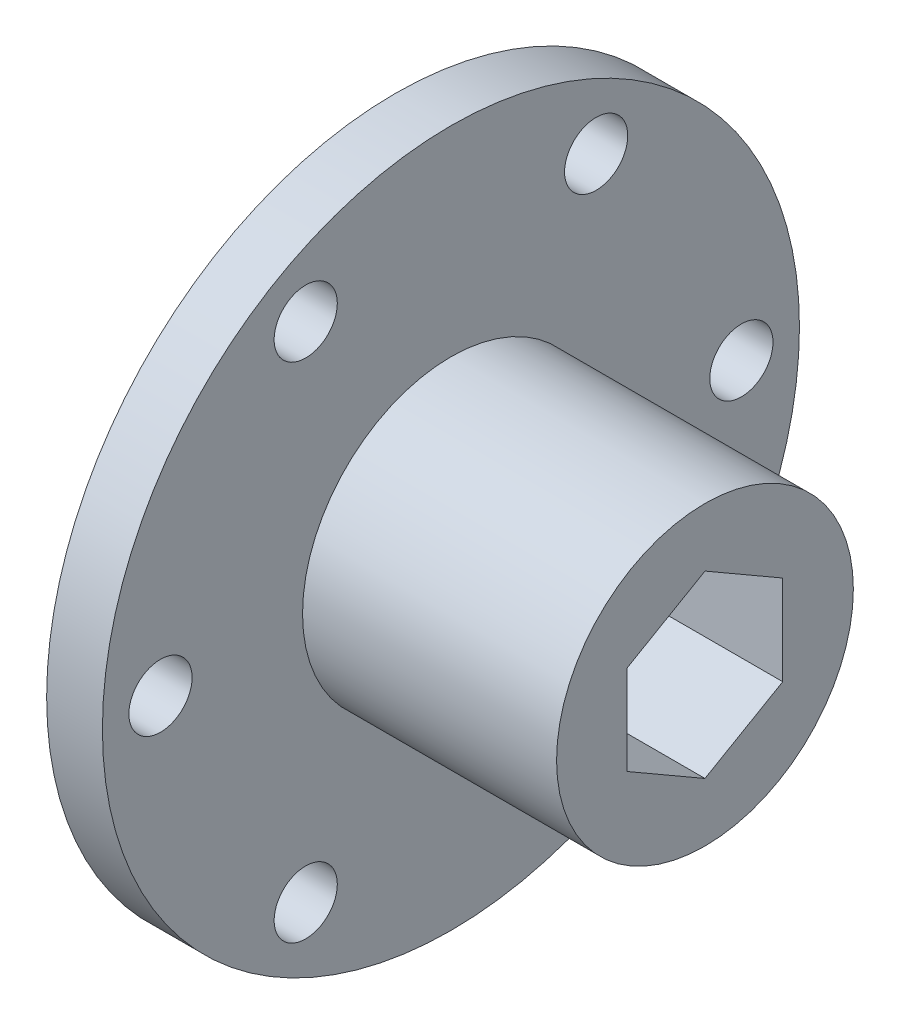
from build123d import *

# Parameters (mm, degrees)
SKETCH1_W           = 4.572
SKETCH1_H           = 28.575
SKETCH2_R           = 12.1666
BOSS_EXTRUDE1_DEPTH = 20.828
CUT_EXTRUDE1_DEPTH  = 48.730716001
HOLE1_D             = 5.1816
HOLE1_DEPTH         = 25.4


with BuildPart() as part:
    # Sketch1 → Revolve1 (revolve)
    with BuildSketch(Plane.XY, mode=Mode.PRIVATE) as revolve1_sk:
        with Locations((-15.321066246, 14.2875)):
            Rectangle(SKETCH1_W, SKETCH1_H)
    revolve(revolve1_sk.sketch.rotate(Axis((-17.607066246, 0, 0), (1, 0, 0)), 270), axis=Axis((-17.607066246, 0, 0), (1, 0, 0)))

    # Sketch2 → Boss-Extrude1 (add)
    with BuildSketch(Plane(origin=(-13.035066246, 0, 0), x_dir=(0, 0, -1), z_dir=(1, 0, 0))):
        Circle(SKETCH2_R)
    extrude(amount=BOSS_EXTRUDE1_DEPTH)

    # Sketch3 → Cut-Extrude1 (cut, through all)
    with BuildSketch(Plane.ZY.offset(17.607066246)):
        Polygon((0, -7.361697812), (6.3754, -3.680858906), (6.3754, 3.680818906), (0, 7.361657812), (-6.3754, 3.680818906), (-6.3754, -3.680858906), align=None)
    extrude(amount=-CUT_EXTRUDE1_DEPTH, mode=Mode.SUBTRACT)

    # Hole1
    with Locations(Plane.ZY.offset(17.607066246)):
        with Locations((11.90625, -20.622229928), (-11.90625, -20.622229928), (-23.8125, 0), (-11.90625, 20.622229928), (11.90625, 20.622229928), (23.8125, 0)):
            Hole(HOLE1_D / 2, depth=HOLE1_DEPTH)


solid = part.part
